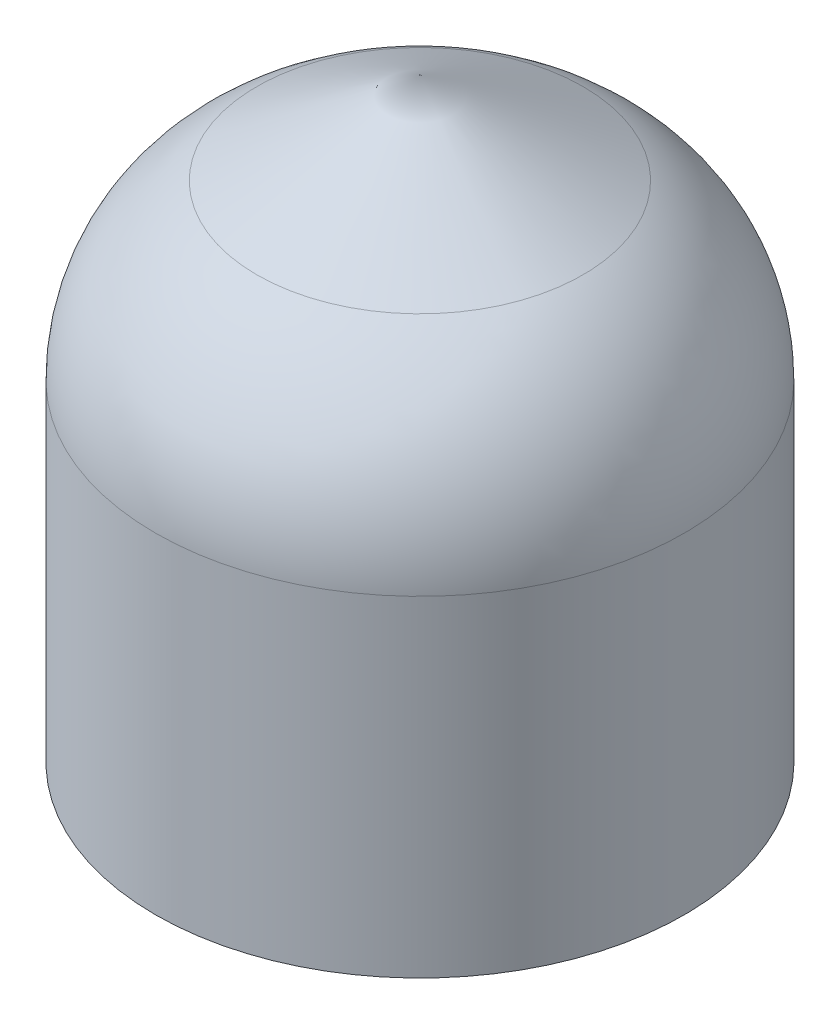
from build123d import *


with BuildPart() as part:
    # Croquis2 → Revolución1 (revolve)
    with BuildSketch(Plane.XY, mode=Mode.PRIVATE) as revoluci_n1_sk:
        with BuildLine():
            Line((-2.5, 0), (-4, 0))
            Line((-4, 0), (-4, 5))
            ThreePointArc((-4, 5), (-3.588568628, 6.516348395), (-2.467125029, 7.616781257))
            Line((-2.467125029, 7.616781257), (0, 9))
            Line((0, 9), (0, 7))
            Line((0, 7), (-2.5, 7))
            Line((-2.5, 7), (-2.5, 0))
        make_face()
    revolve(revoluci_n1_sk.sketch.rotate(Axis((0, 5.661764706, 0), (0, -1, 0)), 270), axis=Axis((0, 5.661764706, 0), (0, -1, 0)))


solid = part.part
